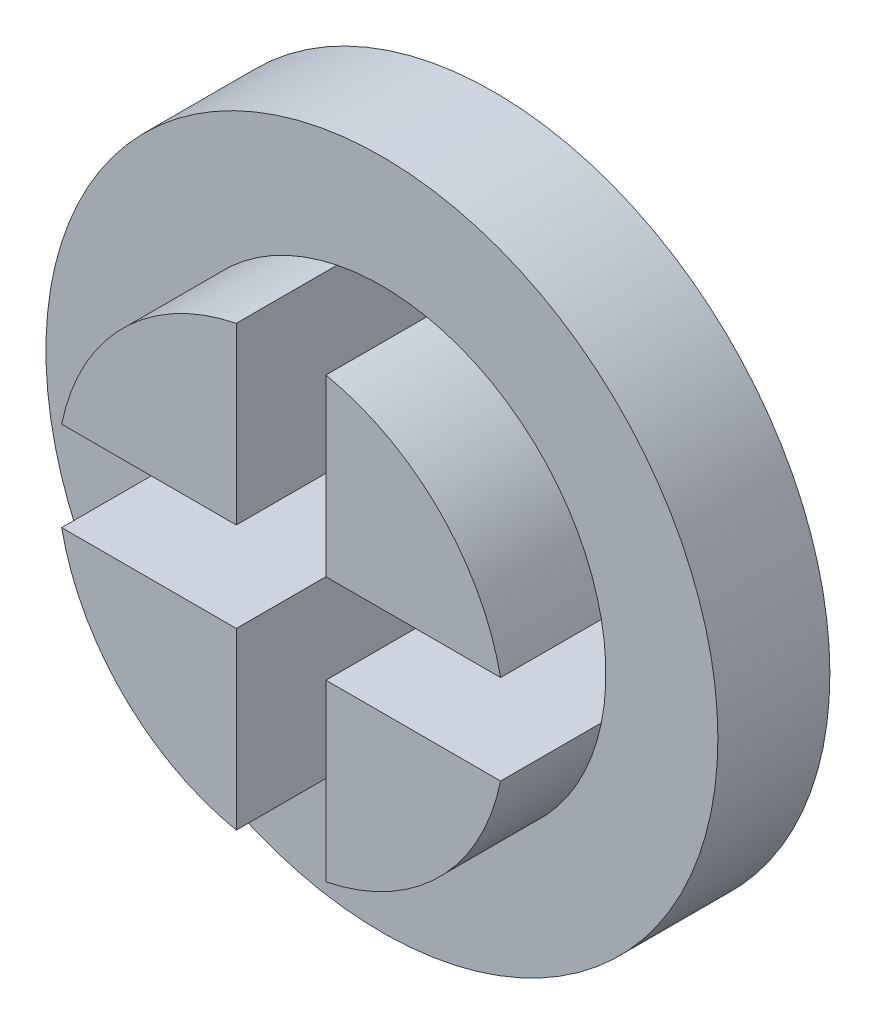
from build123d import *

# Parameters (mm, degrees)
SKETCH1_R           = 15
BOSS_EXTRUDE1_DEPTH = 5
BOSS_EXTRUDE2_DEPTH = 9.5
FILLET1_R           = 0.5


with BuildPart() as part:
    # Sketch1 → Boss-Extrude1 (new body)
    with BuildSketch(Plane.XY):
        Circle(SKETCH1_R)
        with BuildLine():
            ThreePointArc((1.9999999999999991, -9.797958971132713), (-1.84e-15, -10), (-2.0000000000000027, -9.797958971132712))
            ThreePointArc((-2.0000000000000027, -9.797958971132712), (-7.071067811865477, -7.071067811865475), (-9.797958971132712, -1.9999999999999996))
            ThreePointArc((-9.797958971132712, -1.9999999999999996), (-10, 1.22e-15), (-9.797958971132712, 2.000000000000002))
            ThreePointArc((-9.797958971132712, 2.000000000000002), (-7.071067811865475, 7.0710678118654755), (-2.0000000000000004, 9.797958971132712))
            ThreePointArc((-2.0000000000000004, 9.797958971132712), (-1.61e-15, 10), (1.9999999999999993, 9.797958971132713))
            ThreePointArc((1.9999999999999993, 9.797958971132713), (7.0710678118654755, 7.071067811865475), (9.797958971132712, 2))
            ThreePointArc((9.797958971132712, 2), (9.94936153005124, 1.0050896200520818), (10, 0))
            ThreePointArc((10, -2.45e-15), (9.94936153005124, -1.0050896200520847), (9.797958971132712, -2.000000000000003))
            ThreePointArc((9.797958971132712, -2.000000000000003), (7.071067811865474, -7.071067811865477), (1.9999999999999991, -9.797958971132713))
        make_face(mode=Mode.SUBTRACT)
    extrude(amount=BOSS_EXTRUDE1_DEPTH)

    # Sketch1<3> → Boss-Extrude2 (add)
    with BuildSketch(Plane.XY):
        with BuildLine():
            ThreePointArc((-9.797958971132712, -1.9999999999999996), (-7.071067811865477, -7.071067811865475), (-2.0000000000000027, -9.797958971132712))
            Line((-2, -9.797958971132713), (-2, -2))
            Line((-2, -2), (-9.797958971132713, -2))
        make_face()
        with BuildLine():
            Line((2, -2), (2, -9.797958971132713))
            ThreePointArc((1.9999999999999991, -9.797958971132713), (7.071067811865474, -7.071067811865477), (9.797958971132712, -2.000000000000003))
            Line((9.797958971132713, -2), (2, -2))
        make_face()
        with BuildLine():
            Line((-9.797958971132713, 2), (-2, 2))
            Line((-2, 2), (-2, 9.797958971132713))
            ThreePointArc((-2.0000000000000004, 9.797958971132712), (-7.071067811865475, 7.0710678118654755), (-9.797958971132712, 2.000000000000002))
        make_face()
        with BuildLine():
            Line((2, 9.797958971132713), (2, 2))
            Line((2, 2), (9.797958971132713, 2))
            ThreePointArc((9.797958971132712, 2), (7.0710678118654755, 7.071067811865475), (1.9999999999999993, 9.797958971132713))
        make_face()
    extrude(amount=BOSS_EXTRUDE2_DEPTH)

    # Fillet1
    fillet1_edges = [part.edges().sort_by_distance(p)[0] for p in [
        (2, 5.898979485566357, 0),
        (5.898979485566357, 2, 0),
        (10.00000000000005, 0, 0),
        (5.898979485566357, -2, 0),
        (-5.33e-15, -10.000000000000096, 0),
        (2, -5.898979485566357, 0),
        (-2, -5.898979485566357, 0),
        (-5.898979485566357, -2, 0),
        (-10.000000000000043, -8.22e-15, 0),
        (-5.898979485566357, 2, 0),
        (-8.9e-16, 9.999999999999998, 0),
        (-2, 5.898979485566357, 0),
    ]]
    fillet(fillet1_edges, radius=FILLET1_R)


solid = part.part
